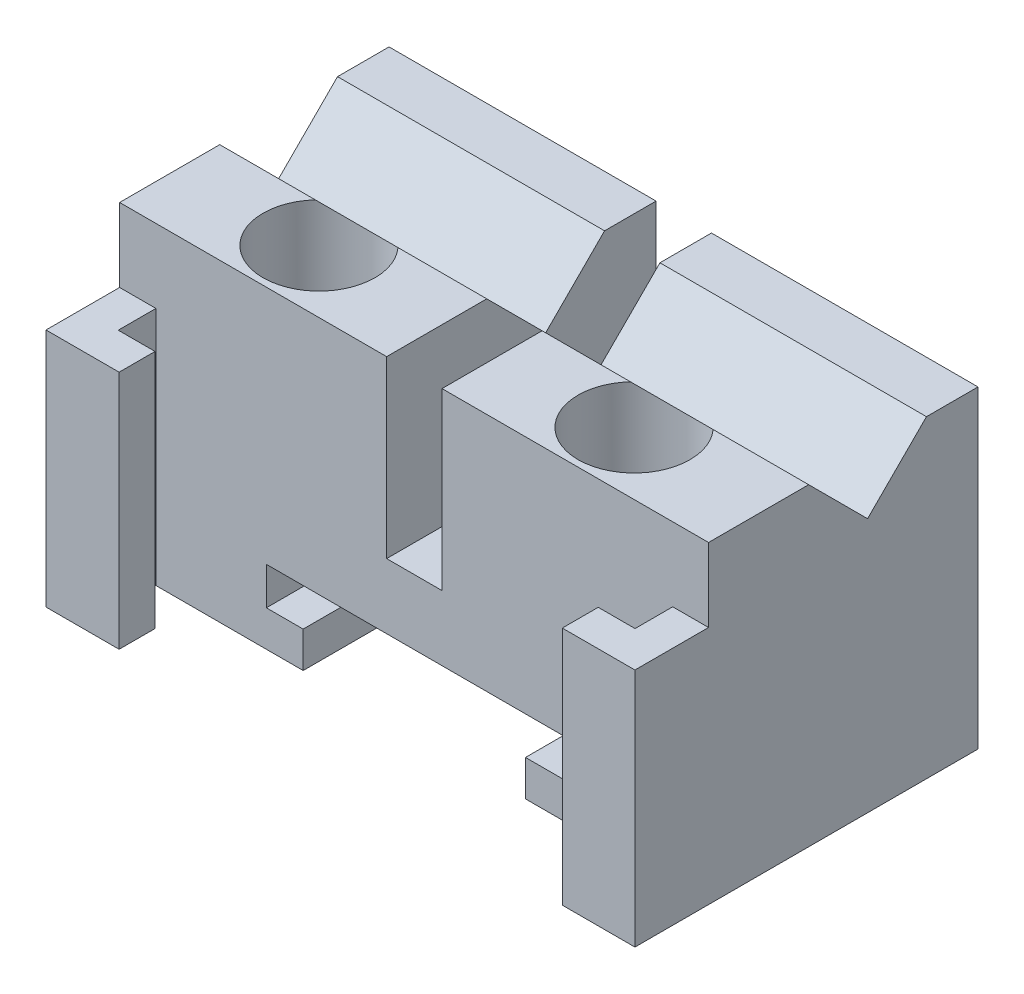
from build123d import *

# Parameters (mm, degrees)
CROQUIS1_W              = 50.8
CROQUIS1_H              = 27.051
SALIENTE_EXTRUIR1_DEPTH = 29.591
CORTAR_EXTRUIR1_DEPTH   = 42.295883595
CROQUIS8_W              = 4.7752
CROQUIS8_H              = 15.0876
CORTAR_EXTRUIR2_DEPTH   = 42.295883595
CORTAR_EXTRUIR3_DEPTH   = 48.472095113
CROQUIS12_R             = 4.826
CORTAR_EXTRUIR4_DEPTH   = 15.875
CROQUIS13_W             = 6.35
CROQUIS13_H             = 6.35
CORTAR_EXTRUIR5_DEPTH   = 61.330540106
CORTAR_EXTRUIR6_DEPTH   = 61.330540106


with BuildPart() as part:
    # Croquis1 → Saliente-Extruir1 (new body)
    with BuildSketch(Plane.XY):
        with Locations((-0.020777573, -0.020967748)):
            Rectangle(CROQUIS1_W, CROQUIS1_H)
    extrude(amount=SALIENTE_EXTRUIR1_DEPTH)

    # Croquis7 → Cortar-Extruir1 (cut, through all)
    with BuildSketch(Plane(origin=(0, 0, 0), x_dir=(-1, 0, 0), z_dir=(0, 0, -1))):
        Polygon((-12.7635, -7.196467748), (12.7635, -7.196467748), (12.7635, -10.447667748), (9.5885, -10.447667748), (9.5885, -13.546467748), (-9.5885, -13.546467748), (-9.5885, -10.447667748), (-12.7635, -10.447667748), align=None)
    extrude(amount=-CORTAR_EXTRUIR1_DEPTH, mode=Mode.SUBTRACT)

    # Croquis8 → Cortar-Extruir2 (cut, through all)
    with BuildSketch(Plane(origin=(0, 0, 0), x_dir=(-1, 0, 0), z_dir=(0, 0, -1))):
        with Locations((0, 5.960732252)):
            Rectangle(CROQUIS8_W, CROQUIS8_H)
    extrude(amount=-CORTAR_EXTRUIR2_DEPTH, mode=Mode.SUBTRACT)

    # Croquis9 → Cortar-Extruir3 (cut, through all)
    with BuildSketch(Plane(origin=(0, 13.504532252, 0), x_dir=(1, 0, 0), z_dir=(0, 1, 0))):
        Polygon((-19.1135, -29.591), (19.1135, -29.591), (19.1135, -26.4922), (22.2885, -26.4922), (22.2885, -23.241), (-22.2885, -23.241), (-22.2885, -26.4922), (-19.1135, -26.4922), align=None)
    extrude(amount=-CORTAR_EXTRUIR3_DEPTH, mode=Mode.SUBTRACT)

    # Croquis12 → Cortar-Extruir4 (cut)
    with BuildSketch(Plane(origin=(0, 13.504532252, 0), x_dir=(1, 0, 0), z_dir=(0, 1, 0))):
        with Locations(Location((-13.609777573, -17.8562, 0), (0, 0, 270))):
            Circle(CROQUIS12_R)
        with Locations(Location((13.568222427, -17.8562, 0), (0, 0, 270))):
            Circle(CROQUIS12_R)
    extrude(amount=-CORTAR_EXTRUIR4_DEPTH, mode=Mode.SUBTRACT)

    # Croquis13 → Cortar-Extruir5 (cut, through all)
    with BuildSketch(Plane(origin=(25.379222427, 0, 0), x_dir=(0, 0, -1), z_dir=(1, 0, 0))):
        with Locations((-26.416, 10.329532252)):
            Rectangle(CROQUIS13_W, CROQUIS13_H)
    extrude(amount=-CORTAR_EXTRUIR5_DEPTH, mode=Mode.SUBTRACT)

    # Croquis14 → Cortar-Extruir6 (cut, through all)
    with BuildSketch(Plane(origin=(25.379222427, 0, 0), x_dir=(0, 0, -1), z_dir=(1, 0, 0))):
        Polygon((-9.525, 8.424532252), (-4.445, 13.504532252), (-14.605, 13.504532252), align=None)
    extrude(amount=-CORTAR_EXTRUIR6_DEPTH, mode=Mode.SUBTRACT)


solid = part.part
